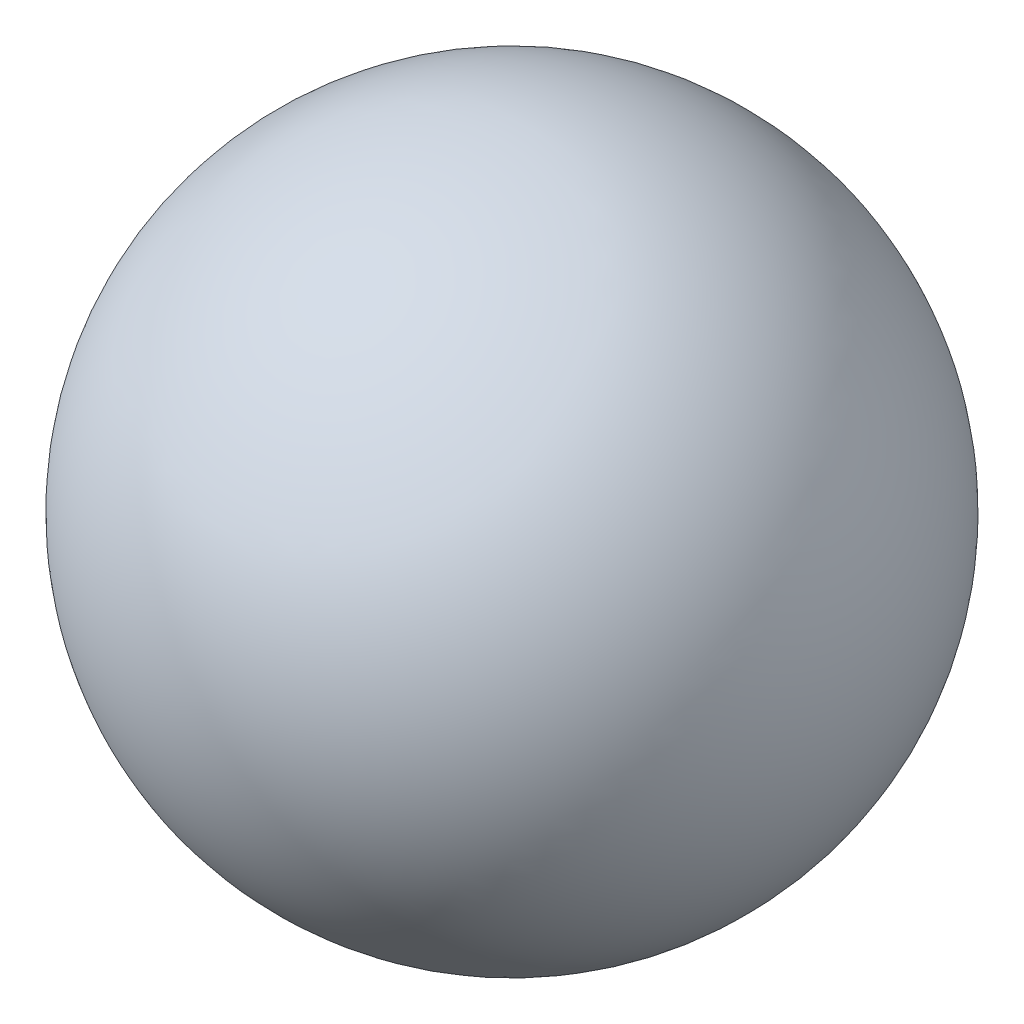
from build123d import *


with BuildPart() as part:
    # 草图1 → 旋转1 (revolve)
    with BuildSketch(Plane(origin=(0, 0, 0), x_dir=(1, 0, 0), z_dir=(0, 1, 0))):
        with BuildLine():
            Line((0, 8.5), (0, -8.5))
            ThreePointArc((0, -8.5), (-8.5, 0), (0, 8.5))
        make_face()
    revolve(axis=Axis((0, 0, -8.5), (0, 0, 1)))


solid = part.part
